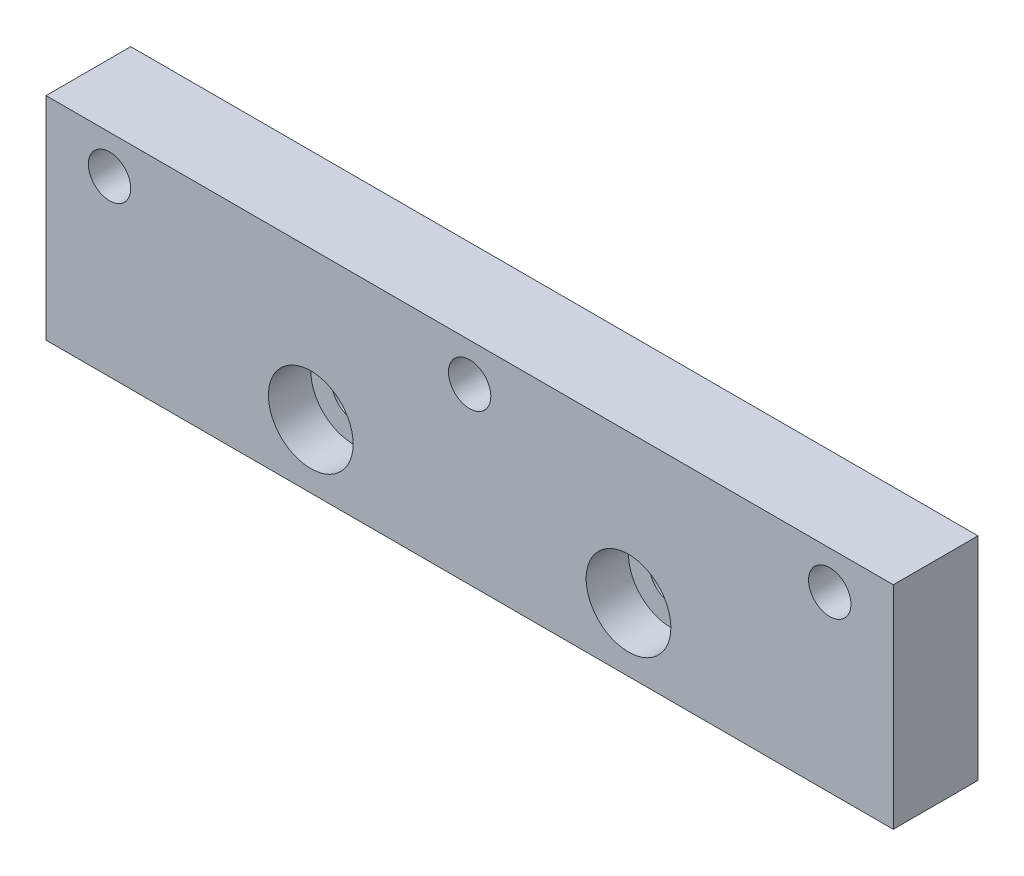
from build123d import *

# Parameters (mm, degrees)
SKETCH2_W           = 40
SKETCH2_H           = 10
BOSS_EXTRUDE1_DEPTH = 4
SKETCH3_R           = 1
CUT_EXTRUDE1_DEPTH  = 22
SKETCH4_R           = 2
CUT_EXTRUDE2_DEPTH  = 2


with BuildPart() as part:
    # Sketch2 → Boss-Extrude1 (new body)
    with BuildSketch(Plane.XY):
        Rectangle(SKETCH2_W, SKETCH2_H)
    extrude(amount=BOSS_EXTRUDE1_DEPTH)

    # Sketch3 → Cut-Extrude1 (cut, through all)
    with BuildSketch(Plane.XY.offset(4)):
        with Locations((-17, 3.2)):
            Circle(SKETCH3_R)
        with Locations((0, 3.2)):
            Circle(SKETCH3_R)
        with Locations((17, 3.2)):
            Circle(SKETCH3_R)
        with Locations((-7.5, -2)):
            Circle(SKETCH3_R)
        with Locations((7.5, -2)):
            Circle(SKETCH3_R)
    extrude(amount=-CUT_EXTRUDE1_DEPTH, mode=Mode.SUBTRACT)

    # Sketch4 → Cut-Extrude2 (cut)
    with BuildSketch(Plane.XY.offset(4)):
        with Locations((-7.5, -2)):
            Circle(SKETCH4_R)
        with Locations((7.5, -2)):
            Circle(SKETCH4_R)
    extrude(amount=-CUT_EXTRUDE2_DEPTH, mode=Mode.SUBTRACT)


solid = part.part
